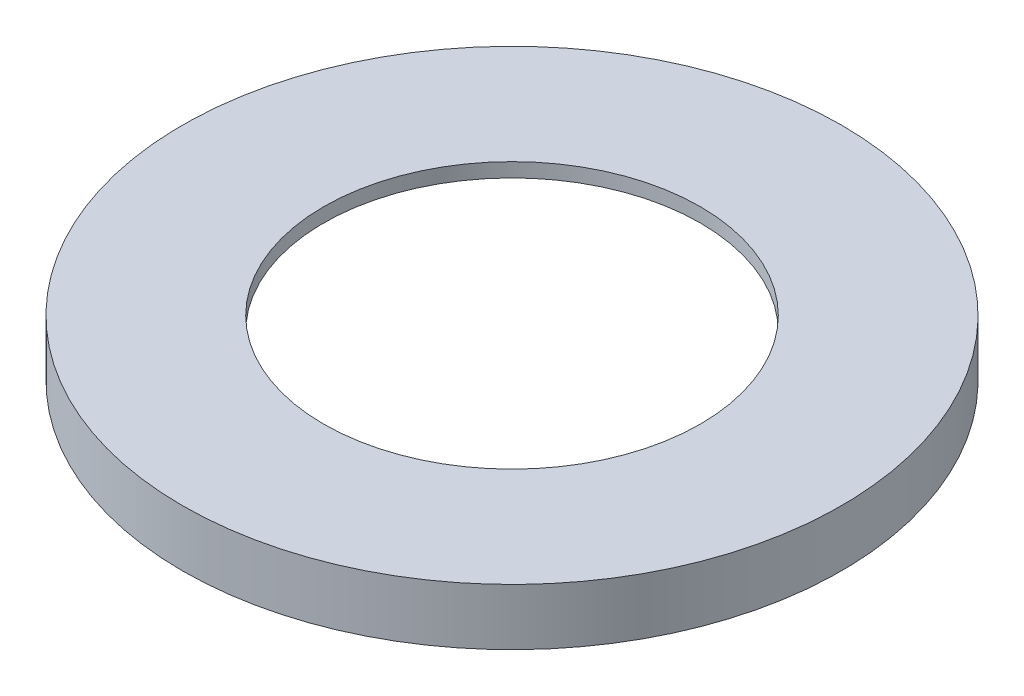
from build123d import *

# Parameters (mm, degrees)
SKETCH1_R           = 35
SKETCH1_R_2         = 20
BOSS_EXTRUDE1_DEPTH = 6
SKETCH2_W           = 11
SKETCH2_H           = 4.5


with BuildPart() as part:
    # Sketch1 → Boss-Extrude1 (new body)
    with BuildSketch(Plane(origin=(0, 0, 0), x_dir=(1, 0, 0), z_dir=(0, 1, 0))):
        with Locations(Location((0, 0, 0), (0, 0, 270))):
            Circle(SKETCH1_R)
        with Locations(Location((0, 0, 0), (0, 0, 270))):
            Circle(SKETCH1_R_2, mode=Mode.SUBTRACT)
    extrude(amount=BOSS_EXTRUDE1_DEPTH)

    # Sketch2 → Cut-Revolve1 (revolve, cut)
    with BuildSketch(Plane(origin=(0, 0, 0), x_dir=(0, 0, -1), z_dir=(1, 0, 0)), mode=Mode.PRIVATE) as cut_revolve1_sk:
        with Locations((-25.5, 2.25)):
            Rectangle(SKETCH2_W, SKETCH2_H)
    revolve(cut_revolve1_sk.sketch.rotate(Axis((0, 0, 0), (0, 1, 0)), 180), axis=Axis((0, 0, 0), (0, 1, 0)), mode=Mode.SUBTRACT)


solid = part.part
